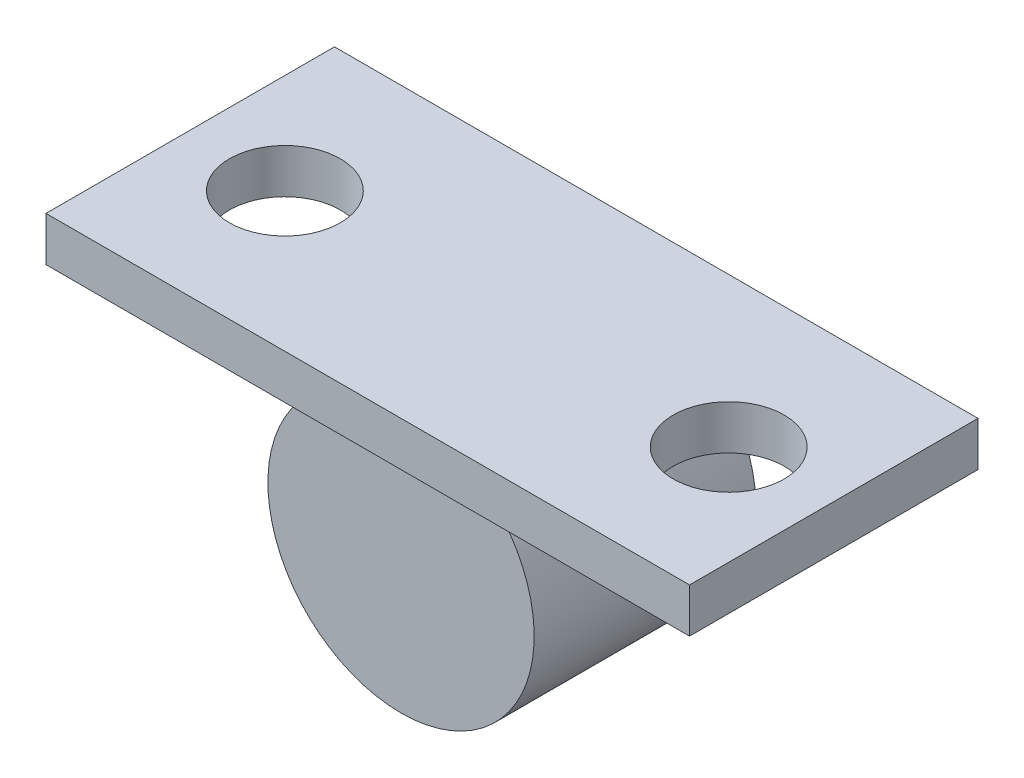
from build123d import *

# Parameters (mm, degrees)
SKETCH_1_W          = 29
SKETCH_1_H          = 13
EXTRUDE_1_DEPTH     = 2
SKETCH_2_R          = 2.5
CUT_EXTRUDE_1_DEPTH = 17.015617378
SKETCH_3_R          = 6
EXTRUDE_2_DEPTH     = 5


with BuildPart() as part:
    # 草图1 → 凸台-拉伸1 (new body)
    with BuildSketch(Plane(origin=(0, 0, 0), x_dir=(1, 0, 0), z_dir=(0, 1, 0))):
        Rectangle(SKETCH_1_W, SKETCH_1_H)
    extrude(amount=-EXTRUDE_1_DEPTH)

    # 草图2 → 切除-拉伸1 (cut, through all)
    with BuildSketch(Plane(origin=(0, 0, 0), x_dir=(1, 0, 0), z_dir=(0, 1, 0))):
        with Locations((-10, -0.234995389)):
            Circle(SKETCH_2_R)
        with Locations((10, -0.234995389)):
            Circle(SKETCH_2_R)
    extrude(amount=-CUT_EXTRUDE_1_DEPTH, mode=Mode.SUBTRACT)

    # 草图3 → 凸台-拉伸2 (add, symmetric)
    with BuildSketch(Plane.XY):
        with Locations((0, -7)):
            Circle(SKETCH_3_R)
    extrude(amount=EXTRUDE_2_DEPTH, both=True)


solid = part.part
